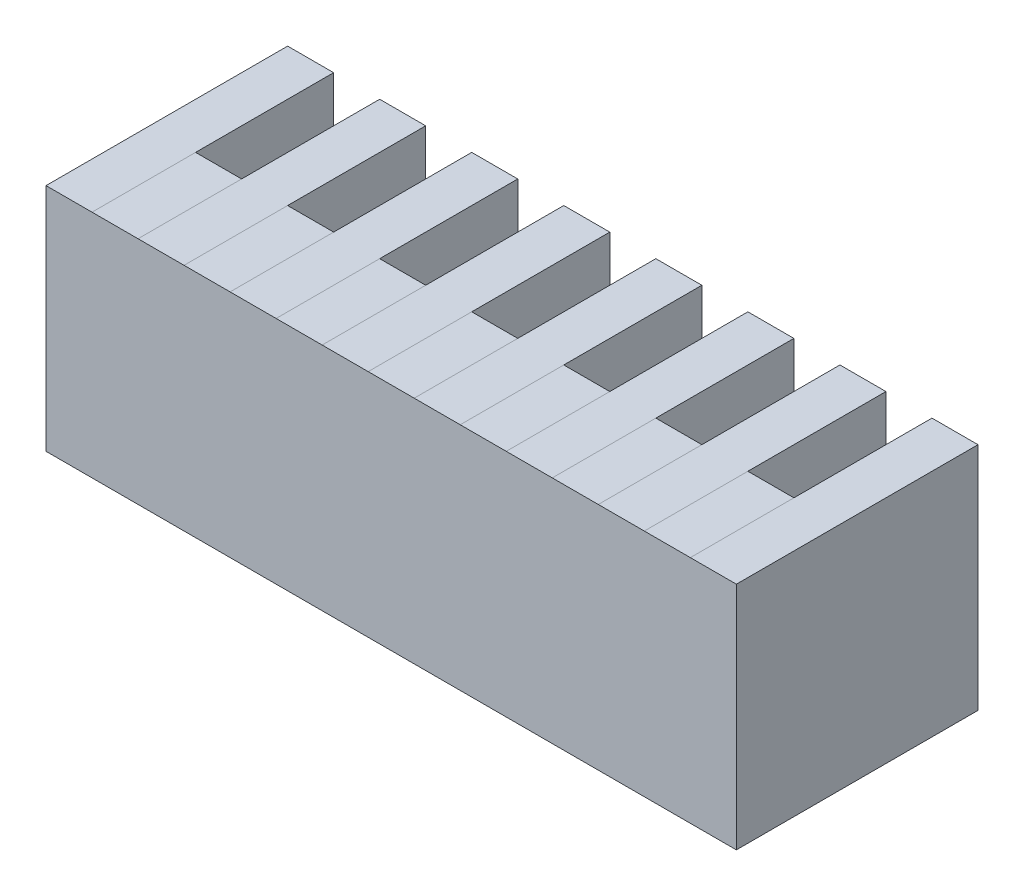
from build123d import *

# Parameters (mm, degrees)
SKETCH1_W           = 30
SKETCH1_H           = 10
BOSS_EXTRUDE1_DEPTH = 10.5
SKETCH3_W           = 2
SKETCH3_H           = 6
CUT_EXTRUDE1_DEPTH  = 34.320414163
LPATTERN1_COUNT     = 13
LPATTERN1_PITCH     = 2


with BuildPart() as part:
    # Sketch1 → Boss-Extrude1 (new body)
    with BuildSketch(Plane.XY):
        with Locations((15, 5)):
            Rectangle(SKETCH1_W, SKETCH1_H)
    extrude(amount=BOSS_EXTRUDE1_DEPTH)

    # Sketch3 → Cut-Extrude1 (cut, symmetric)
    with BuildSketch(Plane.XZ):
        with Locations((3, 3)):
            Rectangle(SKETCH3_W, SKETCH3_H)
    cut_extrude1 = extrude(amount=CUT_EXTRUDE1_DEPTH, both=True, mode=Mode.SUBTRACT)

    # LPattern1: Cut-Extrude1 ×13, 6 skipped
    with Locations(*[(i * LPATTERN1_PITCH, 0, 0) for i in range(1, LPATTERN1_COUNT) if i not in (1, 3, 5, 7, 9, 11)]):
        add(cut_extrude1, mode=Mode.SUBTRACT)


solid = part.part
